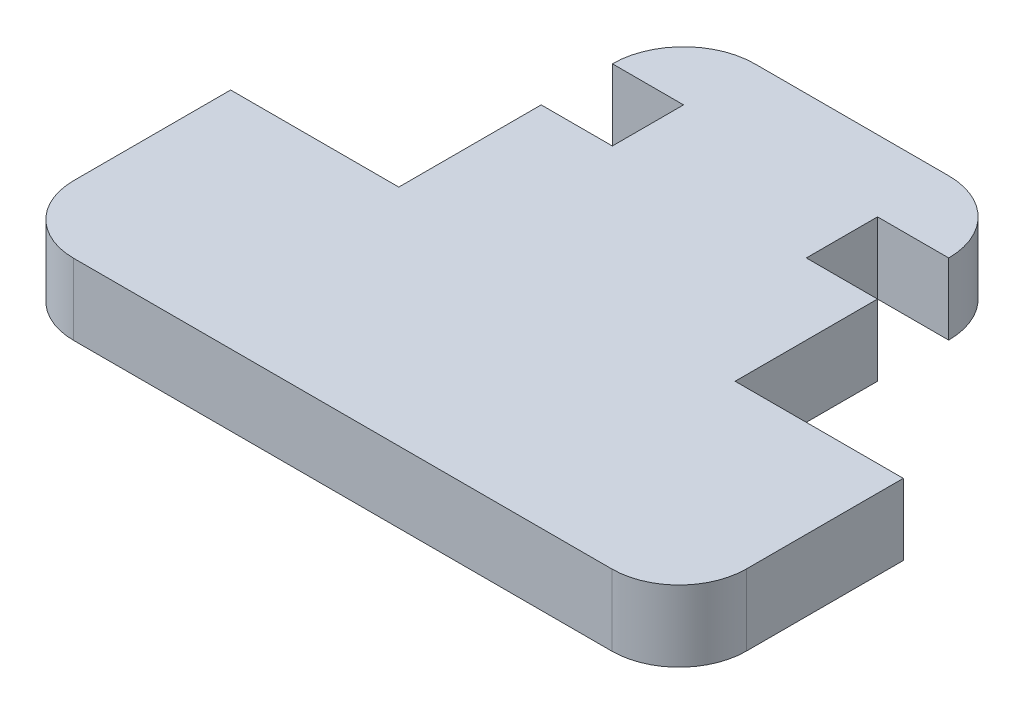
from build123d import *

# Parameters (mm, degrees)
SKETCH1_W           = 30
SKETCH1_H           = 10
BOSS_EXTRUDE2_DEPTH = 3.175
FILLET3_R           = 3


with BuildPart() as part:
    # Sketch1 → Boss-Extrude2 (new body)
    with BuildSketch(Plane(origin=(0, 0, 0), x_dir=(1, 0, 0), z_dir=(0, 1, 0))):
        with Locations((0, -5)):
            Rectangle(SKETCH1_W, SKETCH1_H)
        Polygon((-7.5, 3.175), (-7.5, 0), (7.5, 0), (7.5, 3.175), (7.5, 6.35), (4.325, 6.35), (-3.85, 6.35), (-4.325, 6.35), (-7.5, 6.35), align=None)
        Polygon((-4.325, 9.525), (-4.325, 6.35), (-3.85, 6.35), (4.325, 6.35), (4.325, 9.525), align=None)
        with BuildLine():
            ThreePointArc((-7.5, 9.525), (-6.57006403, 11.77006403), (-4.325, 12.7))
            Line((-4.325, 12.7), (4.325, 12.7))
            ThreePointArc((4.325, 12.7), (6.57006403, 11.77006403), (7.5, 9.525))
            Line((7.5, 9.525), (4.325, 9.525))
            Line((4.325, 9.525), (-4.325, 9.525))
            Line((-4.325, 9.525), (-7.5, 9.525))
        make_face()
    extrude(amount=BOSS_EXTRUDE2_DEPTH)

    # Fillet3
    fillet3_edges = [part.edges().sort_by_distance(p)[0] for p in [
        (15, 1.5875, 10),
        (-15, 1.5875, 10),
    ]]
    fillet(fillet3_edges, radius=FILLET3_R)


solid = part.part
